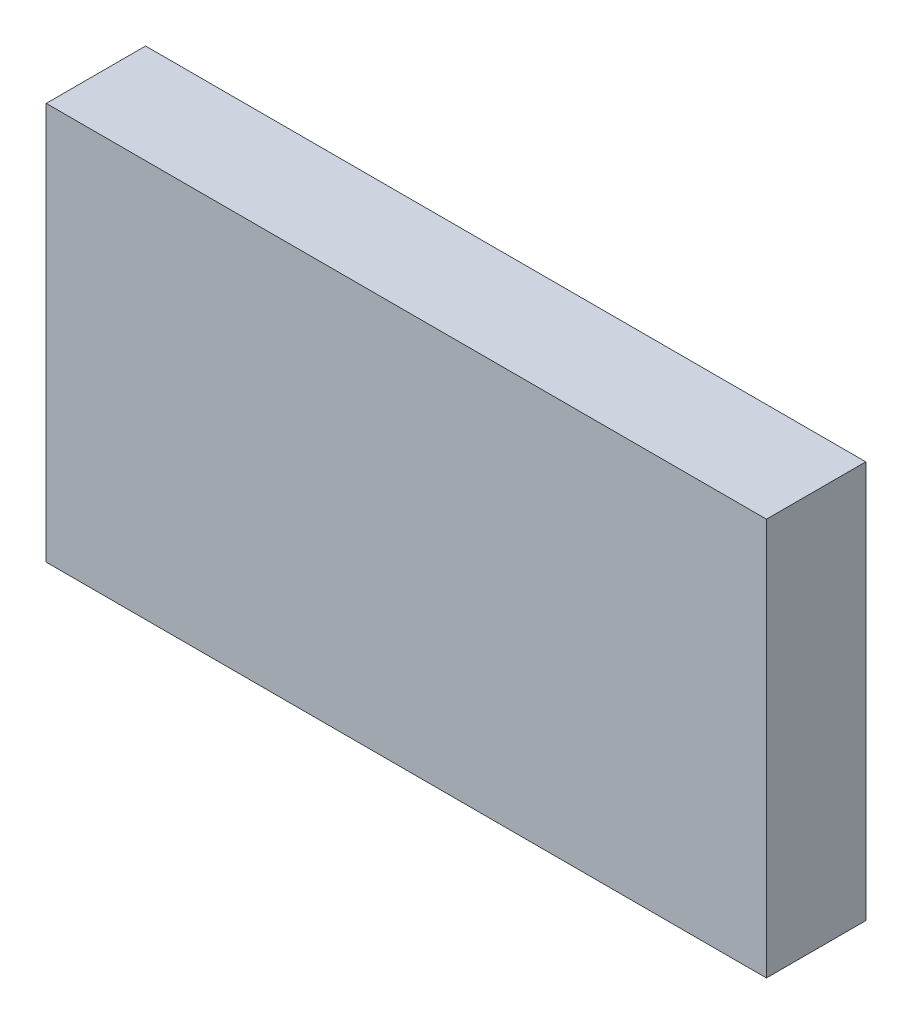
from build123d import *

# Parameters (mm, degrees)
SKETCH_1_W      = 145
SKETCH_1_H      = 80
EXTRUDE_1_DEPTH = 20


with BuildPart() as part:
    # 草图1 → 凸台-拉伸1 (new body)
    with BuildSketch(Plane.XY):
        Rectangle(SKETCH_1_W, SKETCH_1_H)
    extrude(amount=EXTRUDE_1_DEPTH)


solid = part.part
